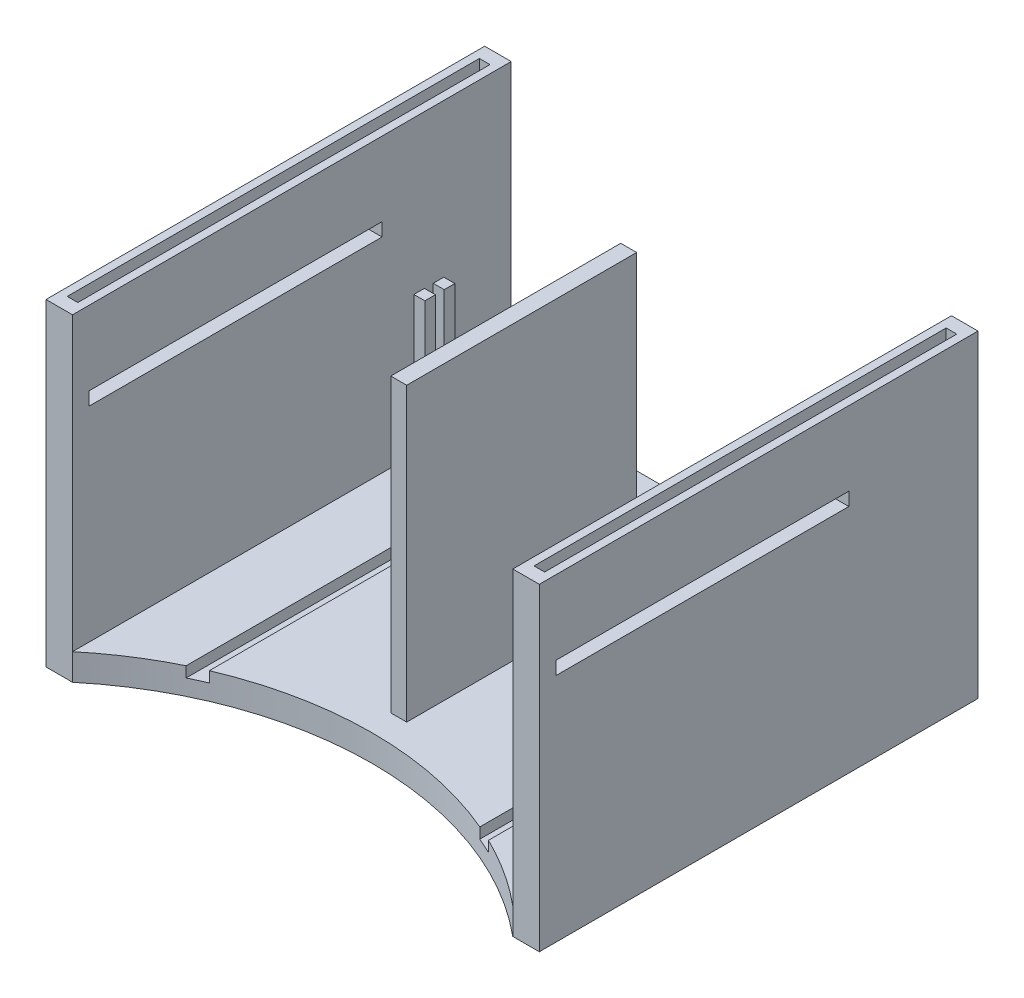
from build123d import *

# Parameters (mm, degrees)
EXTRUDE_THIN2_DEPTH     = 165.4
SKETCH11_W              = 166
SKETCH11_H              = 4
BOSS_EXTRUDE3_DEPTH     = 2.6416
CUT_EXTRUDE6_DEPTH      = 270.69086006
CUT_EXTRUDE6_DEPTH_BACK = 270.69086006
SKETCH13_W              = 110.495011338
SKETCH13_H              = 5
CUT_EXTRUDE7_DEPTH      = 273.127102656
SKETCH19_W              = 4
SKETCH19_H              = 155.4
CUT_EXTRUDE9_DEPTH      = 10
SKETCH20_W              = 4
SKETCH20_H              = 155.4
CUT_EXTRUDE10_DEPTH     = 10
SKETCH21_W              = 6
SKETCH21_H              = 86.697
BOSS_EXTRUDE4_DEPTH     = 110
CUT_EXTRUDE11_DEPTH     = 4
SKETCH23_W              = 166
SKETCH23_H              = 4
BOSS_EXTRUDE5_DEPTH     = 2.6416
SKETCH24_W              = 4.14
SKETCH24_H              = 4
BOSS_EXTRUDE6_DEPTH     = 49.64
SKETCH25_W              = 4.14
SKETCH25_H              = 4
BOSS_EXTRUDE7_DEPTH     = 49.64
SKETCH26_W              = 4.14
SKETCH26_H              = 4
BOSS_EXTRUDE8_DEPTH     = 49.64
SKETCH27_W              = 4.14
SKETCH27_H              = 4
BOSS_EXTRUDE9_DEPTH     = 49.64


with BuildPart() as part:
    # Sketch2 → Extrude-Thin2 (new body)
    with BuildSketch(Plane.XY):
        Polygon((0, 120), (0, 0), (186, 0), (186, 120), (176, 120), (176, 10), (10, 10), (10, 120), align=None)
    extrude(amount=EXTRUDE_THIN2_DEPTH)

    # Sketch11 → Boss-Extrude3 (add)
    with BuildSketch(Plane(origin=(0, 10, 0), x_dir=(1, 0, 0), z_dir=(0, 1, 0))):
        with Locations((93, -34.703)):
            Rectangle(SKETCH11_W, SKETCH11_H)
    extrude(amount=BOSS_EXTRUDE3_DEPTH)

    # Sketch13 → Cut-Extrude6 (cut, two sides: drawn at the far end of the back side and taken through both)
    with BuildSketch(Plane(origin=(10, 0, 0), x_dir=(0, 0, -1), z_dir=(1, 0, 0)).offset(-CUT_EXTRUDE6_DEPTH_BACK)):
        with Locations((-103.947505669, 89.551599899)):
            Rectangle(SKETCH13_W, SKETCH13_H)
    extrude(amount=CUT_EXTRUDE6_DEPTH + CUT_EXTRUDE6_DEPTH_BACK, mode=Mode.SUBTRACT)

    # Sketch14 → Cut-Extrude7 (cut, through all)
    with BuildSketch(Plane(origin=(0, 10, 0), x_dir=(1, 0, 0), z_dir=(0, 1, 0))):
        with BuildLine():
            Line((176, -165.4), (10, -165.4))
            ThreePointArc((10, -165.4), (93, -135.4), (176, -165.4))
        make_face()
    extrude(amount=-CUT_EXTRUDE7_DEPTH, mode=Mode.SUBTRACT)

    # Sketch19 → Cut-Extrude9 (cut)
    with BuildSketch(Plane(origin=(0, 120, 0), x_dir=(1, 0, 0), z_dir=(0, 1, 0))):
        with Locations((5, -82.7)):
            Rectangle(SKETCH19_W, SKETCH19_H)
    extrude(amount=-CUT_EXTRUDE9_DEPTH, mode=Mode.SUBTRACT)

    # Sketch20 → Cut-Extrude10 (cut)
    with BuildSketch(Plane(origin=(0, 120, 0), x_dir=(1, 0, 0), z_dir=(0, 1, 0))):
        with Locations((181, -82.7)):
            Rectangle(SKETCH20_W, SKETCH20_H)
    extrude(amount=-CUT_EXTRUDE10_DEPTH, mode=Mode.SUBTRACT)

    # Sketch21 → Boss-Extrude4 (add, through all)
    with BuildSketch(Plane(origin=(0, 10, 0), x_dir=(1, 0, 0), z_dir=(0, 1, 0))):
        with Locations((93, -82.0515)):
            Rectangle(SKETCH21_W, SKETCH21_H)
    extrude(amount=BOSS_EXTRUDE4_DEPTH)

    # Sketch22 → Cut-Extrude11 (cut)
    with BuildSketch(Plane(origin=(0, 10, 0), x_dir=(1, 0, 0), z_dir=(0, 1, 0))):
        Polygon((36, -48.703), (36, -148.583194008), (42, -145.837577441), (42, -48.703), align=None)
        Polygon((144, -145.837577441), (150, -148.583194008), (150, -48.703), (144, -48.703), align=None)
    extrude(amount=-CUT_EXTRUDE11_DEPTH, mode=Mode.SUBTRACT)

    # Sketch23 → Boss-Extrude5 (add)
    with BuildSketch(Plane(origin=(0, 10, 0), x_dir=(1, 0, 0), z_dir=(0, 1, 0))):
        with Locations((93, -27.4)):
            Rectangle(SKETCH23_W, SKETCH23_H)
    extrude(amount=BOSS_EXTRUDE5_DEPTH)

    # Sketch24 → Boss-Extrude6 (add)
    with BuildSketch(Plane(origin=(0, 12.6416, 0), x_dir=(1, 0, 0), z_dir=(0, 1, 0))):
        with Locations((12.07, -27.4)):
            Rectangle(SKETCH24_W, SKETCH24_H)
    extrude(amount=BOSS_EXTRUDE6_DEPTH)

    # Sketch25 → Boss-Extrude7 (add)
    with BuildSketch(Plane(origin=(0, 12.6416, 0), x_dir=(1, 0, 0), z_dir=(0, 1, 0))):
        with Locations((173.93, -27.4)):
            Rectangle(SKETCH25_W, SKETCH25_H)
    extrude(amount=BOSS_EXTRUDE7_DEPTH)

    # Sketch26 → Boss-Extrude8 (add)
    with BuildSketch(Plane(origin=(0, 12.6416, 0), x_dir=(1, 0, 0), z_dir=(0, 1, 0))):
        with Locations((12.07, -34.703)):
            Rectangle(SKETCH26_W, SKETCH26_H)
    extrude(amount=BOSS_EXTRUDE8_DEPTH)

    # Sketch27 → Boss-Extrude9 (add)
    with BuildSketch(Plane(origin=(0, 12.6416, 0), x_dir=(1, 0, 0), z_dir=(0, 1, 0))):
        with Locations((173.93, -34.703)):
            Rectangle(SKETCH27_W, SKETCH27_H)
    extrude(amount=BOSS_EXTRUDE9_DEPTH)


solid = part.part
